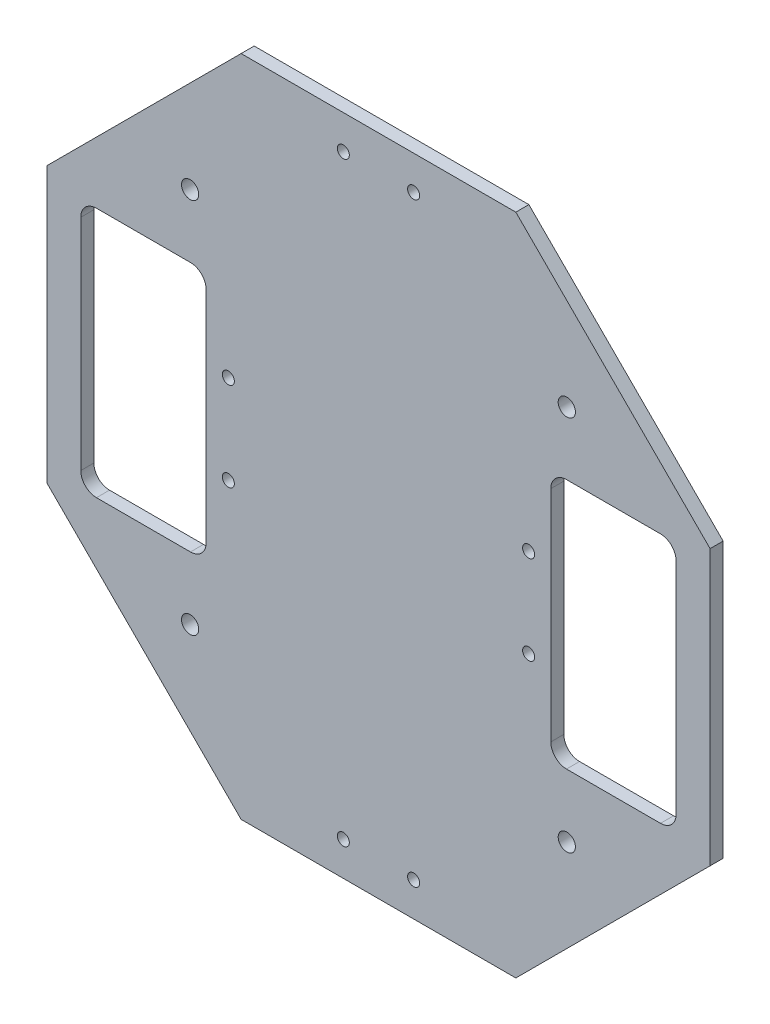
from build123d import *

# Parameters (mm, degrees)
RESSALTO_EXTRUS_O1_DEPTH = 2.5
ESBO_O2_R                = 1.15
CORTE_EXTRUS_O1_DEPTH    = 90.837353033
ESBO_O4_R                = 1.65
CORTE_EXTRUS_O2_DEPTH    = 40.5


with BuildPart() as part:
    # Esboço1 → Ressalto-extrusão1 (new body)
    with BuildSketch(Plane.XY):
        Polygon((63.5, -26.302561211), (63.5, 26.302561211), (26.302561211, 63.5), (-26.302561211, 63.5), (-63.5, 26.302561211), (-63.5, -26.302561211), (-26.302561211, -63.5), (26.302561211, -63.5), align=None)
    extrude(amount=RESSALTO_EXTRUS_O1_DEPTH)

    # Esboço2 → Corte-extrusão1 (cut, through all)
    with BuildSketch(Plane(origin=(0, 0, 0), x_dir=(-1, 0, 0), z_dir=(0, 0, -1))):
        with Locations((28.75, 8.5)):
            Circle(ESBO_O2_R)
        with Locations(Location((28.75, -8.5, 0), (0, 0, 180))):
            Circle(ESBO_O2_R)
        with Locations((-28.75, -8.5)):
            Circle(ESBO_O2_R)
        with Locations(Location((-28.75, 8.5, 0), (0, 0, 180))):
            Circle(ESBO_O2_R)
        with Locations((-6.731, -57)):
            Circle(ESBO_O2_R)
        with Locations(Location((6.731, -57, 0), (0, 0, 180))):
            Circle(ESBO_O2_R)
        with Locations((6.731, 57)):
            Circle(ESBO_O2_R)
        with Locations(Location((-6.731, 57, 0), (0, 0, 180))):
            Circle(ESBO_O2_R)
        with BuildLine():
            Line((54, 24), (36, 24))
            ThreePointArc((36, 24), (33.878679656, 23.121320344), (33, 21))
            Line((33, 21), (33, -21))
            ThreePointArc((33, -21), (33.878679656, -23.121320344), (36, -24))
            Line((36, -24), (54, -24))
            ThreePointArc((54, -24), (56.121320344, -23.121320344), (57, -21))
            Line((57, -21), (57, 21))
            ThreePointArc((57, 21), (56.121320344, 23.121320344), (54, 24))
        make_face()
        with BuildLine():
            Line((-33, 21), (-33, -21))
            ThreePointArc((-33, -21), (-33.878679656, -23.121320344), (-36, -24))
            Line((-36, -24), (-54, -24))
            ThreePointArc((-54, -24), (-56.121320344, -23.121320344), (-57, -21))
            Line((-57, -21), (-57, 21))
            ThreePointArc((-57, 21), (-56.121320344, 23.121320344), (-54, 24))
            Line((-54, 24), (-36, 24))
            ThreePointArc((-36, 24), (-33.878679656, 23.121320344), (-33, 21))
        make_face()
    extrude(amount=-CORTE_EXTRUS_O1_DEPTH, mode=Mode.SUBTRACT)

    # Esboço4 → Corte-extrusão2 (cut)
    with BuildSketch(Plane(origin=(0, 0, 0), x_dir=(-1, 0, 0), z_dir=(0, 0, -1))):
        with Locations((36.062445841, -36.062445841)):
            Circle(ESBO_O4_R)
        with Locations((36.062445841, 36.062445841)):
            Circle(ESBO_O4_R)
        with Locations((-36.062445841, -36.062445841)):
            Circle(ESBO_O4_R)
        with Locations((-36.062445841, 36.062445841)):
            Circle(ESBO_O4_R)
    extrude(amount=-CORTE_EXTRUS_O2_DEPTH, mode=Mode.SUBTRACT)


solid = part.part
